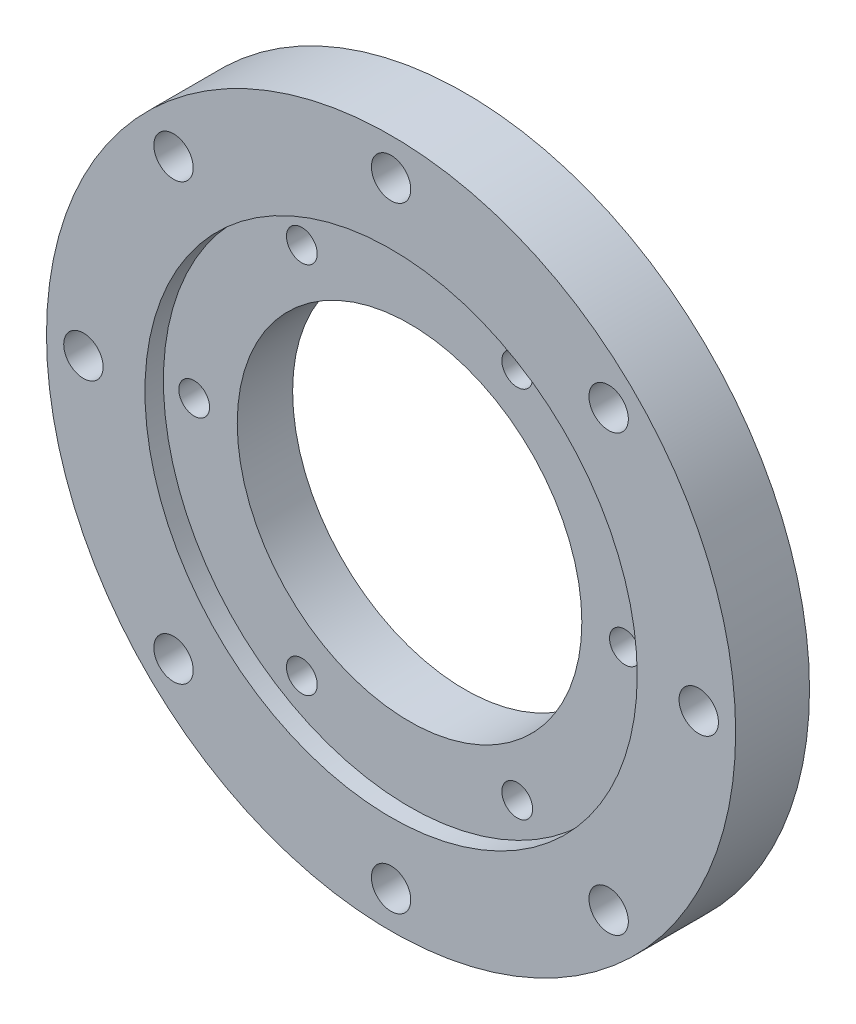
from build123d import *

# Parameters (mm, degrees)
SKETCH_1_R          = 28
SKETCH_1_R_2        = 14
EXTRUDE_1_DEPTH     = 6
CUT_EXTRUDE_START   = 4.5
SKETCH_1_4_R        = 20
SKETCH_1_4_R_2      = 14
CUT_EXTRUDE_1_DEPTH = 1.5
M3X0_5_1_D          = 2.5
HOLE_WIZARD_M3_1_D  = 3.2


with BuildPart() as part:
    # ｽｹｯﾁ1 → ﾎﾞｽ - 押し出し1 (new body)
    with BuildSketch(Plane.XY):
        Circle(SKETCH_1_R)
        Circle(SKETCH_1_R_2, mode=Mode.SUBTRACT)
    extrude(amount=EXTRUDE_1_DEPTH)

    # ｽｹｯﾁ1<4> → ｶｯﾄ - 押し出し1 (cut)
    with BuildSketch(Plane.XY.offset(CUT_EXTRUDE_START)):
        Circle(SKETCH_1_4_R)
        Circle(SKETCH_1_4_R_2, mode=Mode.SUBTRACT)
    extrude(amount=CUT_EXTRUDE_1_DEPTH, mode=Mode.SUBTRACT)

    # M3x0.5 ねじ穴用ねじ下穴ﾄﾞﾘﾙ1 (through all)
    with Locations(Plane(origin=(17.5, 0, 0), x_dir=(-1, 0, 0), z_dir=(0, 0, -1))):
        with Locations((0, 0), (8.75, -15.155444566), (26.25, -15.155444566), (35, 0), (26.25, 15.155444566), (8.75, 15.155444566)):
            Hole(M3X0_5_1_D / 2)

    # M3 すきま穴1 (through all)
    with Locations(Plane(origin=(0, 25, 0), x_dir=(-1, 0, 0), z_dir=(0, 0, -1))):
        with Locations((0, 0), (-17.67766953, -7.32233047), (-25, -25), (-17.67766953, -42.67766953), (0, -50), (17.67766953, -42.67766953), (25, -25), (17.67766953, -7.32233047)):
            Hole(HOLE_WIZARD_M3_1_D / 2)


solid = part.part
